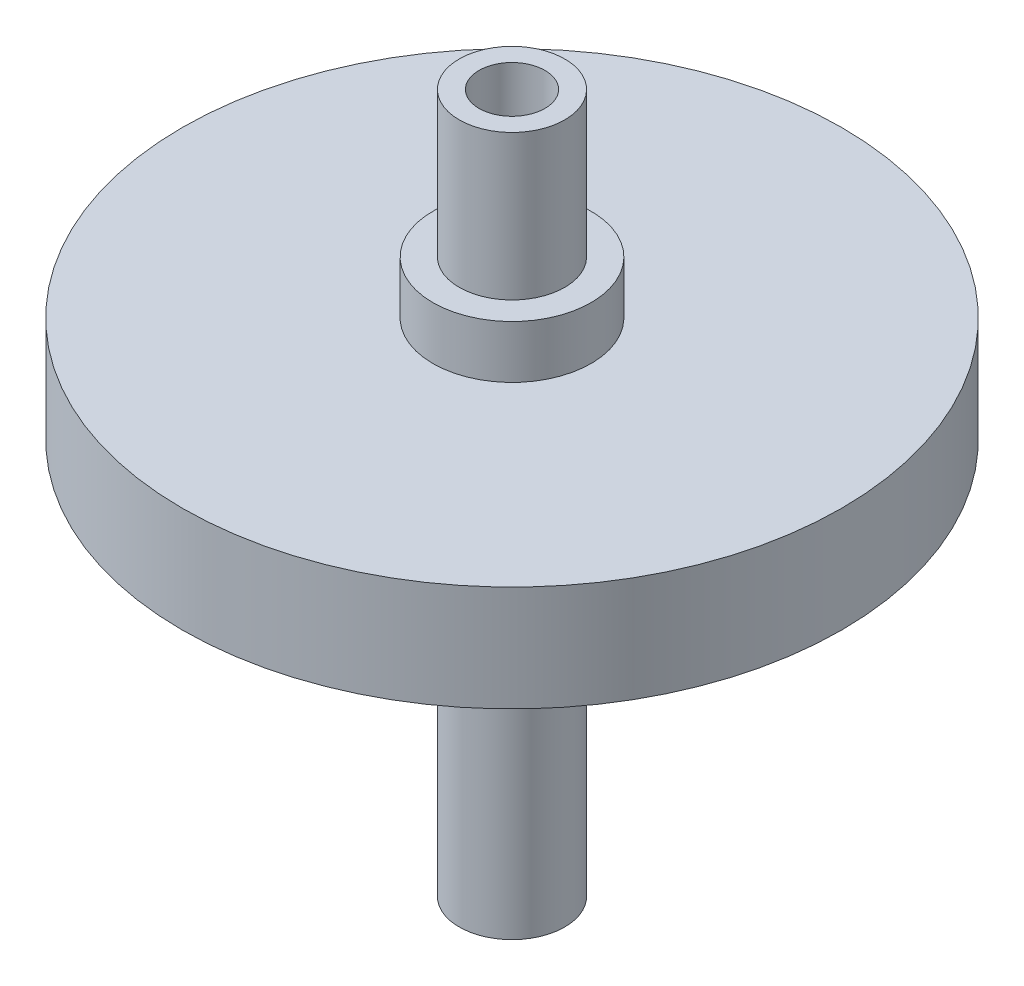
from build123d import *

# Parameters (mm, degrees)
SKETCH1_R               = 25
BOSS_EXTRUDE1_DEPTH     = 8
SKETCH2_R               = 4
BOSS_EXTRUDE2_DEPTH     = 15
BOSS_EXTRUDE3_START     = 30
SKETCH3_R               = 4
BOSS_EXTRUDE3_DEPTH     = 30
CUT_EXTRUDE1_DEPTH      = 64.710281745
CUT_EXTRUDE1_DEPTH_BACK = 64.710281745
SKETCH4_R               = 2.5
SKETCH5_R               = 6
BOSS_EXTRUDE4_DEPTH     = 4
BOSS_EXTRUDE5_START     = 4
SKETCH6_R               = 6
BOSS_EXTRUDE5_DEPTH     = 4


with BuildPart() as part:
    # Sketch1 → Boss-Extrude1 (new body)
    with BuildSketch(Plane(origin=(0, 0, 0), x_dir=(1, 0, 0), z_dir=(0, 1, 0))):
        with Locations(Location((0, 0, 0), (0, 0, 270))):
            Circle(SKETCH1_R)
    extrude(amount=BOSS_EXTRUDE1_DEPTH)

    # Sketch2 → Boss-Extrude2 (add)
    with BuildSketch(Plane(origin=(0, 8, 0), x_dir=(1, 0, 0), z_dir=(0, 1, 0))):
        with Locations(Location((0, 0, 0), (0, 0, 270))):
            Circle(SKETCH2_R)
    extrude(amount=BOSS_EXTRUDE2_DEPTH)

    # Sketch3 → Boss-Extrude3 (add)
    with BuildSketch(Plane.XZ.offset(BOSS_EXTRUDE3_START)):
        with Locations(Location((0, 0, 0), (0, 0, 90))):
            Circle(SKETCH3_R)
    extrude(amount=-BOSS_EXTRUDE3_DEPTH)

    # Sketch4 → Cut-Extrude1 (cut, two sides: drawn at the far end of the back side and taken through both)
    with BuildSketch(Plane(origin=(0, 23, 0), x_dir=(1, 0, 0), z_dir=(0, 1, 0)).offset(-CUT_EXTRUDE1_DEPTH_BACK)):
        with Locations(Location((0, 0, 0), (0, 0, 270))):
            Circle(SKETCH4_R)
    extrude(amount=CUT_EXTRUDE1_DEPTH + CUT_EXTRUDE1_DEPTH_BACK, mode=Mode.SUBTRACT)

    # Sketch5 → Boss-Extrude4 (add)
    with BuildSketch(Plane.XZ):
        with Locations(Location((0, 0, 0), (0, 0, 90))):
            Circle(SKETCH5_R)
    extrude(amount=BOSS_EXTRUDE4_DEPTH)

    # Sketch6 → Boss-Extrude5 (add)
    with BuildSketch(Plane(origin=(0, 8, 0), x_dir=(1, 0, 0), z_dir=(0, 1, 0)).offset(BOSS_EXTRUDE5_START)):
        with Locations(Location((0, 0, 0), (0, 0, 270))):
            Circle(SKETCH6_R)
    extrude(amount=-BOSS_EXTRUDE5_DEPTH)


solid = part.part
